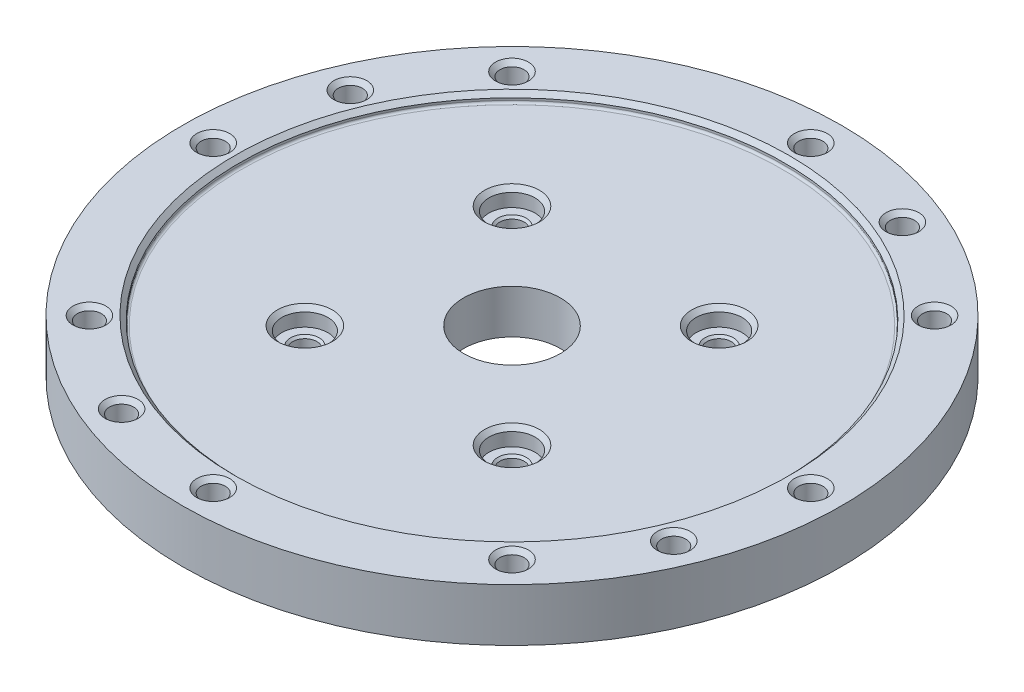
from build123d import *

# Parameters (mm, degrees)
SKETCH1_R           = 75
SKETCH1_R_2         = 11
BOSS_EXTRUDE1_DEPTH = 12
SKETCH2_R           = 2.75
CUT_EXTRUDE1_DEPTH  = 107.742681248
SKETCH3_R           = 5.25
CUT_EXTRUDE2_DEPTH  = 6
SKETCH4_R           = 62.1
CUT_EXTRUDE3_DEPTH  = 2
SKETCH5_R           = 2.75
CUT_EXTRUDE4_DEPTH  = 107.742681248
SKETCH8_R           = 5.5
CUT_EXTRUDE5_DEPTH  = 5
FILLET1_R           = 0.5
CHAMFER1_SIZE       = 1
CHAMFER2_SIZE       = 1
CHAMFER3_SIZE       = 1
CHAMFER4_SIZE       = 0.5


with BuildPart() as part:
    # Sketch1 → Boss-Extrude1 (new body)
    with BuildSketch(Plane(origin=(0, 0, 0), x_dir=(1, 0, 0), z_dir=(0, 1, 0))):
        Circle(SKETCH1_R)
        Circle(SKETCH1_R_2, mode=Mode.SUBTRACT)
    extrude(amount=BOSS_EXTRUDE1_DEPTH)

    # Sketch2 → Cut-Extrude1 (cut, through all)
    with BuildSketch(Plane(origin=(0, 12, 0), x_dir=(1, 0, 0), z_dir=(0, 1, 0))):
        with Locations((-23.57, 23.57)):
            Circle(SKETCH2_R)
        with Locations((23.57, 23.57)):
            Circle(SKETCH2_R)
        with Locations((-23.57, -23.57)):
            Circle(SKETCH2_R)
        with Locations((23.57, -23.57)):
            Circle(SKETCH2_R)
    extrude(amount=-CUT_EXTRUDE1_DEPTH, mode=Mode.SUBTRACT)

    # Sketch3 → Cut-Extrude2 (cut)
    with BuildSketch(Plane(origin=(0, 12, 0), x_dir=(1, 0, 0), z_dir=(0, 1, 0))):
        with Locations((-23.57, 23.57)):
            Circle(SKETCH3_R)
        with Locations((23.57, 23.57)):
            Circle(SKETCH3_R)
        with Locations((-23.57, -23.57)):
            Circle(SKETCH3_R)
        with Locations((23.57, -23.57)):
            Circle(SKETCH3_R)
    extrude(amount=-CUT_EXTRUDE2_DEPTH, mode=Mode.SUBTRACT)

    # Sketch4 → Cut-Extrude3 (cut)
    with BuildSketch(Plane(origin=(0, 12, 0), x_dir=(1, 0, 0), z_dir=(0, 1, 0))):
        Circle(SKETCH4_R)
    extrude(amount=-CUT_EXTRUDE3_DEPTH, mode=Mode.SUBTRACT)

    # Sketch5 → Cut-Extrude4 (cut, through all)
    with BuildSketch(Plane(origin=(0, 12, 0), x_dir=(1, 0, 0), z_dir=(0, 1, 0))):
        with Locations((0, 68)):
            Circle(SKETCH5_R)
        with Locations((48.083261121, 48.083261121)):
            Circle(SKETCH5_R)
        with Locations((68, 0)):
            Circle(SKETCH5_R)
        with Locations((48.083261121, -48.083261121)):
            Circle(SKETCH5_R)
        with Locations((0, -68)):
            Circle(SKETCH5_R)
        with Locations((-48.083261121, -48.083261121)):
            Circle(SKETCH5_R)
        with Locations((-68, 0)):
            Circle(SKETCH5_R)
        with Locations((-48.083261121, 48.083261121)):
            Circle(SKETCH5_R)
        with Locations((26.022473401, 62.823808211)):
            Circle(SKETCH5_R)
        with Locations((62.823808211, -26.022473401)):
            Circle(SKETCH5_R)
        with Locations((-26.022473401, -62.823808211)):
            Circle(SKETCH5_R)
        with Locations((-62.823808211, 26.022473401)):
            Circle(SKETCH5_R)
    extrude(amount=-CUT_EXTRUDE4_DEPTH, mode=Mode.SUBTRACT)

    # Sketch8 → Cut-Extrude5 (cut)
    with BuildSketch(Plane.XZ):
        with Locations((0, 68)):
            Circle(SKETCH8_R)
        with Locations((-48.083261121, 48.083261121)):
            Circle(SKETCH8_R)
        with Locations((48.083261121, 48.083261121)):
            Circle(SKETCH8_R)
        with Locations((48.083261121, -48.083261121)):
            Circle(SKETCH8_R)
        with Locations((0, -68)):
            Circle(SKETCH8_R)
        with Locations((-48.083261121, -48.083261121)):
            Circle(SKETCH8_R)
        with Locations((-68, 0)):
            Circle(SKETCH8_R)
        with Locations((68, 0)):
            Circle(SKETCH8_R)
    extrude(amount=-CUT_EXTRUDE5_DEPTH, mode=Mode.SUBTRACT)

    # Fillet1
    fillet1_edges = [part.edges().sort_by_distance(p)[0] for p in [
        (-62.1, 10, 0),
    ]]
    fillet(fillet1_edges, radius=FILLET1_R)

    # Chamfer1
    chamfer1_edges = [part.edges().sort_by_distance(p)[0] for p in [
        (-62.1, 12, 0),
    ]]
    chamfer(chamfer1_edges, length=CHAMFER1_SIZE)

    # Chamfer2
    chamfer2_edges = [part.edges().sort_by_distance(p)[0] for p in [
        (-2.75, 12, 68),
        (-70.75, 12, 0),
        (-50.833261121, 12, 48.083261121),
        (45.333261121, 12, 48.083261121),
        (65.25, 12, 0),
        (45.333261121, 12, -48.083261121),
        (23.272473401, 12, -62.823808211),
        (-2.75, 12, -68),
        (-50.833261121, 12, -48.083261121),
        (-28.82, 10, -23.57),
        (18.32, 10, -23.57),
        (18.32, 10, 23.57),
        (-28.82, 10, 23.57),
        (60.073808211, 12, 26.022473401),
        (-28.772473401, 12, 62.823808211),
        (-65.573808211, 12, -26.022473401),
    ]]
    chamfer(chamfer2_edges, length=CHAMFER2_SIZE)

    # Chamfer3
    chamfer3_edges = [part.edges().sort_by_distance(p)[0] for p in [
        (-5.5, 0, 68),
        (42.583261121, 0, 48.083261121),
        (62.5, 0, 0),
        (42.583261121, 0, -48.083261121),
        (-5.5, 0, -68),
        (-53.583261121, 0, -48.083261121),
        (-73.5, 0, 0),
        (-53.583261121, 0, 48.083261121),
    ]]
    chamfer(chamfer3_edges, length=CHAMFER3_SIZE)

    # Chamfer4
    chamfer4_edges = [part.edges().sort_by_distance(p)[0] for p in [
        (-26.32, 6, 23.57),
        (20.82, 6, 23.57),
        (20.82, 6, -23.57),
        (-26.32, 6, -23.57),
    ]]
    chamfer(chamfer4_edges, length=CHAMFER4_SIZE)


solid = part.part
